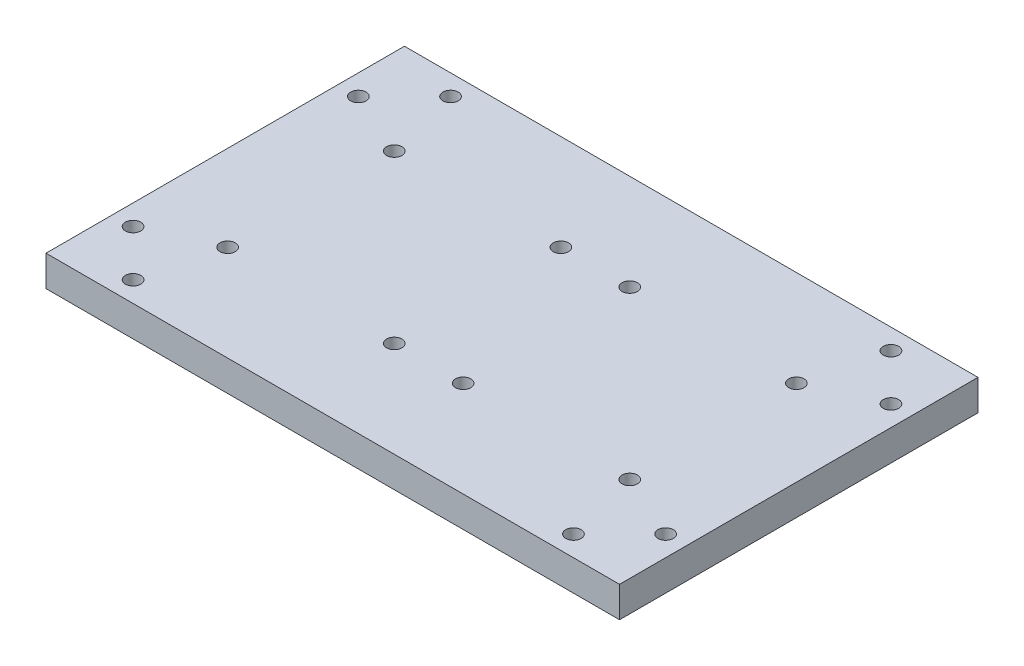
from build123d import *

# Parameters (mm, degrees)
SKETCH1_W           = 112
SKETCH1_H           = 70
BOSS_EXTRUDE1_DEPTH = 6
SKETCH2_R           = 1.5
CUT_EXTRUDE1_DEPTH  = 6
SKETCH3_R           = 1.5
CUT_EXTRUDE2_DEPTH  = 10


with BuildPart() as part:
    # Sketch1 → Boss-Extrude1 (new body)
    with BuildSketch(Plane(origin=(0, 0, 0), x_dir=(1, 0, 0), z_dir=(0, 1, 0))):
        with Locations((56, 35)):
            Rectangle(SKETCH1_W, SKETCH1_H)
    extrude(amount=BOSS_EXTRUDE1_DEPTH)

    # Sketch2 → Cut-Extrude1 (cut)
    with BuildSketch(Plane(origin=(0, 6, 0), x_dir=(1, 0, 0), z_dir=(0, 1, 0))):
        with Locations(Location((62.735, 51.265, 0), (0, 0, 270))):
            Circle(SKETCH2_R)
        with Locations(Location((95.265, 51.265, 0), (0, 0, 270))):
            Circle(SKETCH2_R)
        with Locations(Location((62.735, 18.735, 0), (0, 0, 270))):
            Circle(SKETCH2_R)
        with Locations(Location((95.265, 18.735, 0), (0, 0, 270))):
            Circle(SKETCH2_R)
        with Locations(Location((16.735, 18.735, 0), (0, 0, 90))):
            Circle(SKETCH2_R)
        with Locations(Location((16.735, 51.265, 0), (0, 0, 90))):
            Circle(SKETCH2_R)
        with Locations(Location((49.265, 51.265, 0), (0, 0, 90))):
            Circle(SKETCH2_R)
        with Locations(Location((49.265, 18.735, 0), (0, 0, 90))):
            Circle(SKETCH2_R)
    extrude(amount=-CUT_EXTRUDE1_DEPTH, mode=Mode.SUBTRACT)

    # Sketch3 → Cut-Extrude2 (cut)
    with BuildSketch(Plane(origin=(0, 6, 0), x_dir=(1, 0, 0), z_dir=(0, 1, 0))):
        with Locations(Location((4, 57, 0), (0, 0, 270))):
            Circle(SKETCH3_R)
        with Locations(Location((13, 66, 0), (0, 0, 270))):
            Circle(SKETCH3_R)
        with Locations(Location((99, 66, 0), (0, 0, 90))):
            Circle(SKETCH3_R)
        with Locations(Location((108, 57, 0), (0, 0, 90))):
            Circle(SKETCH3_R)
        with Locations(Location((108, 13, 0), (0, 0, 270))):
            Circle(SKETCH3_R)
        with Locations(Location((99, 4, 0), (0, 0, 270))):
            Circle(SKETCH3_R)
        with Locations(Location((13, 4, 0), (0, 0, 90))):
            Circle(SKETCH3_R)
        with Locations(Location((4, 13, 0), (0, 0, 90))):
            Circle(SKETCH3_R)
    extrude(amount=-CUT_EXTRUDE2_DEPTH, mode=Mode.SUBTRACT)


solid = part.part
